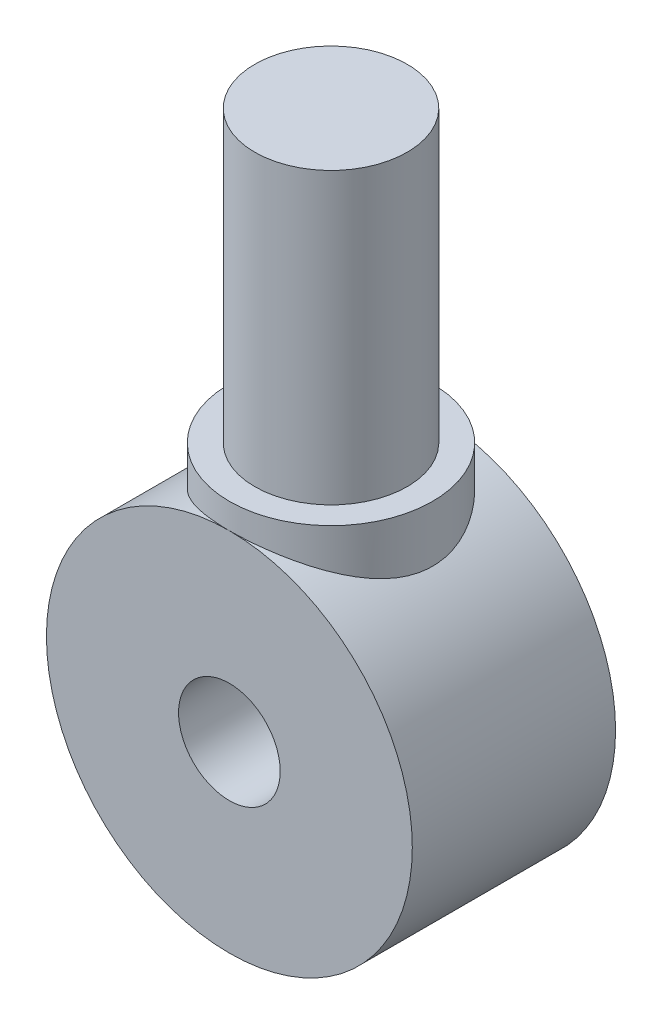
from build123d import *
from build123d.topology import SkipClean

# Parameters (mm, degrees)
SKETCH_1_R          = 18
SKETCH_1_R_2        = 5
EXTRUDE_1_DEPTH     = 20
SKETCH_2_R          = 10
EXTRUDE_2_DEPTH     = 35
SKETCH_4_R          = 15
SKETCH_4_R_2        = 7.5
CUT_EXTRUDE_3_DEPTH = 28.5


with BuildPart() as part:
    # Эскиз1 → Вытянуть1 (new body)
    with BuildSketch(Plane.XY):
        Circle(SKETCH_1_R)
        Circle(SKETCH_1_R_2, mode=Mode.SUBTRACT)
    extrude(amount=EXTRUDE_1_DEPTH)

    # Эскиз2 → Вытянуть2 (add)
    with SkipClean():  # the faces are left unmerged after this step: merging them gives an invalid solid
        with BuildSketch(Plane(origin=(0, 14, 0), x_dir=(1, 0, 0), z_dir=(0, 1, 0))):
            with Locations(Location((0, -10, 0), (0, 0, 270))):
                Circle(SKETCH_2_R)
        extrude(amount=EXTRUDE_2_DEPTH)

    # Эскиз4 → Вытянуть3 (cut)
    with SkipClean():  # the faces are left unmerged after this step: merging them gives an invalid solid
        with BuildSketch(Plane(origin=(0, 49, 0), x_dir=(1, 0, 0), z_dir=(0, 1, 0))):
            with Locations((0, -10)):
                Circle(SKETCH_4_R)
            with Locations(Location((0, -10, 0), (0, 0, 270))):
                Circle(SKETCH_4_R_2, mode=Mode.SUBTRACT)
        extrude(amount=-CUT_EXTRUDE_3_DEPTH, mode=Mode.SUBTRACT)


solid = part.part
